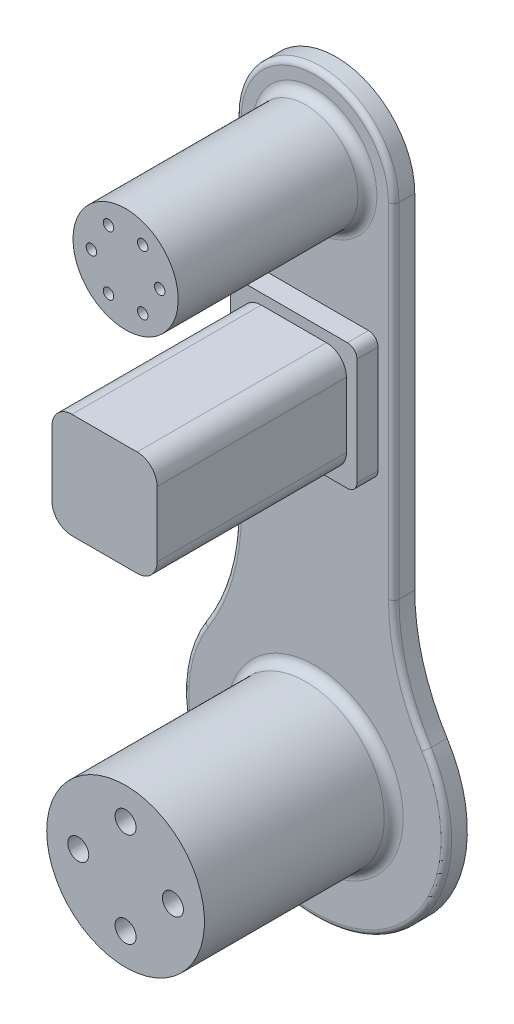
from build123d import *

# Parameters (mm, degrees)
SKETCH1_R             = 50
BOSS_EXTRUDE1_DEPTH   = 90
SKETCH1_R_2           = 75
BOSS_EXTRUDE1_2_DEPTH = 90
SKETCH2_R             = 10
SKETCH2_R_2           = 5
CUT_EXTRUDE1_DEPTH    = 40
BOSS_EXTRUDE2_DEPTH   = 20
BOSS_EXTRUDE3_DEPTH   = 20
FILLET1_R             = 19
SKETCH5_W             = 120
SKETCH5_H             = 120
BOSS_EXTRUDE4_DEPTH   = 20
SKETCH6_W             = 100
SKETCH6_H             = 100
BOSS_EXTRUDE5_DEPTH   = 180
FILLET2_R             = 19
FILLET3_R             = 9
FILLET4_R             = 5


with BuildPart() as part:
    # Sketch1 → Boss-Extrude1 (new, symmetric)
    with BuildSketch(Plane.XY):
        with Locations(Location((0, 250, 0), (0, 0, 180))):
            Circle(SKETCH1_R)
    extrude(amount=BOSS_EXTRUDE1_DEPTH, both=True)


with BuildPart() as body_2:
    # Sketch1 → Boss-Extrude1 2 (new, symmetric)
    with BuildSketch(Plane.XY):
        with Locations(Location((0, -250, 0), (0, 0, 180))):
            Circle(SKETCH1_R_2)
    extrude(amount=BOSS_EXTRUDE1_2_DEPTH, both=True)


with BuildPart() as cut_extrude1_tool:
    # Sketch2 → Cut-Extrude1 (new body)
    with BuildSketch(Plane.XY.offset(90)):
        with Locations((-45, -250)):
            Circle(SKETCH2_R)
        with Locations((0, -205)):
            Circle(SKETCH2_R)
        with Locations((45, -250)):
            Circle(SKETCH2_R)
        with Locations((0, -295)):
            Circle(SKETCH2_R)
        with Locations((-32.5, 250)):
            Circle(SKETCH2_R_2)
        with Locations((-16.25, 278.145825623)):
            Circle(SKETCH2_R_2)
        with Locations((16.25, 278.145825623)):
            Circle(SKETCH2_R_2)
        with Locations((32.5, 250)):
            Circle(SKETCH2_R_2)
        with Locations((16.25, 221.854174377)):
            Circle(SKETCH2_R_2)
        with Locations((-16.25, 221.854174377)):
            Circle(SKETCH2_R_2)
    extrude(amount=-CUT_EXTRUDE1_DEPTH)


with BuildPart() as part_1:
    add(part.part)

    # Cut-Extrude1: cut by cut_extrude1_tool
    add(cut_extrude1_tool.part, mode=Mode.SUBTRACT)



with BuildPart() as body_2_1:
    add(body_2.part)

    # Cut-Extrude1: cut by cut_extrude1_tool
    add(cut_extrude1_tool.part, mode=Mode.SUBTRACT)


with BuildPart() as part_2:
    add(part_1.part)

    add(body_2_1.part)  # Boss-Extrude2 merges body 2
    # Sketch3 → Boss-Extrude2 (add)
    with BuildSketch(Plane(origin=(0, 0, -90), x_dir=(-1, 0, 0), z_dir=(0, 0, -1))):
        with BuildLine():
            Line((-75, 250), (-75, -76.794919243))
            ThreePointArc((-75, -76.794919243), (-82.846215434, -132.264938866), (-105.769230769, -183.382661247))
            ThreePointArc((-105.769230769, -183.382661247), (0, -375), (105.769230769, -183.382661247))
            ThreePointArc((105.769230769, -183.382661247), (82.846215434, -132.264938866), (75, -76.794919243))
            Line((75, -76.794919243), (75, 250))
            ThreePointArc((75, 250), (0, 325), (-75, 250))
        make_face()
    extrude(amount=BOSS_EXTRUDE2_DEPTH)

    # Sketch4 → Boss-Extrude3 (add)
    with BuildSketch(Plane(origin=(0, 0, -110), x_dir=(-1, 0, 0), z_dir=(0, 0, -1))):
        with BuildLine():
            Line((-55, 250), (-55, -76.794919243))
            ThreePointArc((-55, -76.794919243), (-63.630836977, -137.811940828), (-88.846153846, -194.041435448))
            ThreePointArc((-88.846153846, -194.041435448), (0, -355), (88.846153846, -194.041435448))
            ThreePointArc((88.846153846, -194.041435448), (63.630836977, -137.811940828), (55, -76.794919243))
            Line((55, -76.794919243), (55, 250))
            ThreePointArc((55, 250), (0, 305), (-55, 250))
        make_face()
    extrude(amount=BOSS_EXTRUDE3_DEPTH)

    # Fillet1
    fillet1_edges = [part_2.edges().sort_by_distance(p)[0] for p in [
        (0, 305, -130),
        (55, 86.602540378, -130),
        (63.630836977, -137.811940828, -130),
        (0, -355, -130),
        (-63.630836977, -137.811940828, -130),
        (-55, 86.602540378, -130),
    ]]
    fillet(fillet1_edges, radius=FILLET1_R)

    # Sketch5 → Boss-Extrude4 (add)
    with BuildSketch(Plane.XY.offset(-90)):
        with Locations((0, 75)):
            Rectangle(SKETCH5_W, SKETCH5_H)
    extrude(amount=BOSS_EXTRUDE4_DEPTH)

    # Sketch6 → Boss-Extrude5 (add)
    with BuildSketch(Plane.XY.offset(-70)):
        with Locations((0, 75)):
            Rectangle(SKETCH6_W, SKETCH6_H)
    extrude(amount=BOSS_EXTRUDE5_DEPTH)

    # Fillet2
    fillet2_edges = [part_2.edges().sort_by_distance(p)[0] for p in [
        (-50, 25, 20),
        (50, 25, 20),
        (50, 125, 20),
        (-50, 125, 20),
    ]]
    fillet(fillet2_edges, radius=FILLET2_R)

    # Fillet3
    fillet3_edges = [part_2.edges().sort_by_distance(p)[0] for p in [
        (60, 15, -80),
        (60, 135, -80),
        (-60, 135, -80),
        (-60, 15, -80),
        (50, 250, -90),
        (75, -250, -90),
    ]]
    fillet(fillet3_edges, radius=FILLET3_R)

    # Fillet4
    fillet4_edges = [part_2.edges().sort_by_distance(p)[0] for p in [
        (0, 325, -90),
        (75, 86.602540378, -90),
        (82.846215434, -132.264938866, -90),
        (0, -375, -90),
        (-82.846215434, -132.264938866, -90),
        (-75, 86.602540378, -90),
    ]]
    fillet(fillet4_edges, radius=FILLET4_R)


solid = part_2.part
